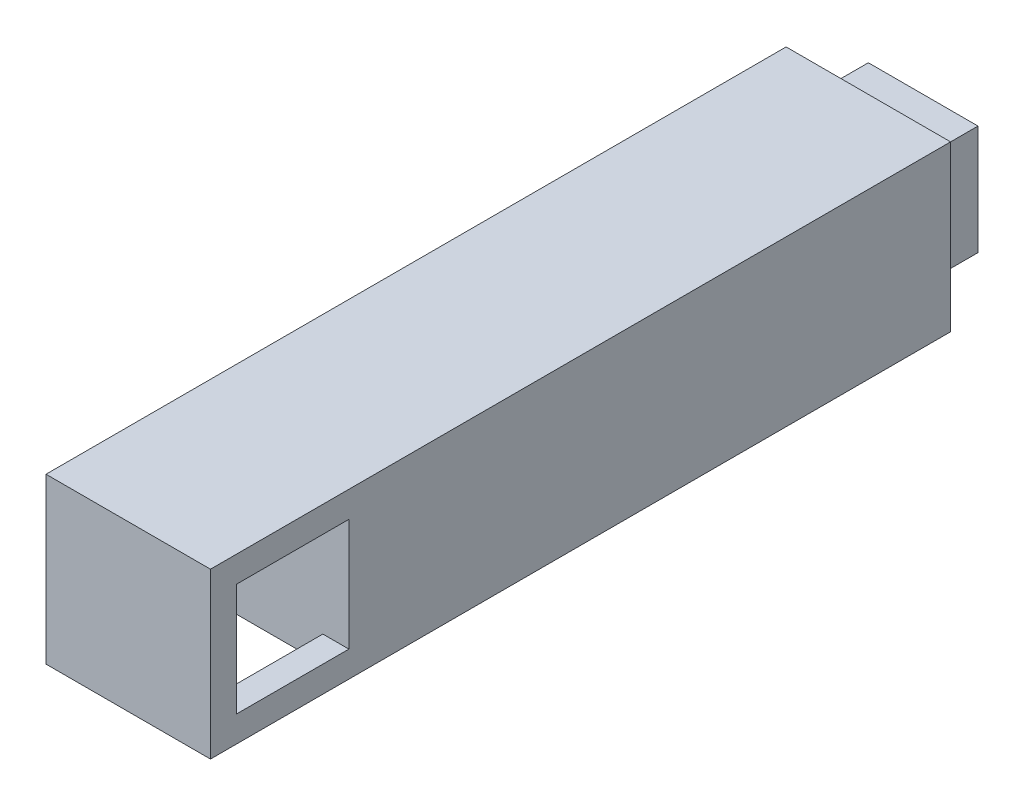
from build123d import *

# Parameters (mm, degrees)
SKETCH1_W           = 30
SKETCH1_H           = 30
BOSS_EXTRUDE1_DEPTH = 135
SKETCH2_W           = 20
SKETCH2_H           = 20
BOSS_EXTRUDE2_DEPTH = 10
SKETCH3_W           = 20.5
SKETCH3_H           = 20.5
CUT_EXTRUDE1_DEPTH  = 15
SKETCH4_W           = 20.5
SKETCH4_H           = 20.5
CUT_EXTRUDE3_DEPTH  = 15


with BuildPart() as part:
    # Sketch1 → Boss-Extrude1 (new body)
    with BuildSketch(Plane.XY):
        Rectangle(SKETCH1_W, SKETCH1_H)
    extrude(amount=BOSS_EXTRUDE1_DEPTH)

    # Sketch2 → Boss-Extrude2 (add)
    with BuildSketch(Plane.XY):
        Rectangle(SKETCH2_W, SKETCH2_H)
    extrude(amount=-BOSS_EXTRUDE2_DEPTH)

    # Sketch3 → Cut-Extrude1 (cut)
    with BuildSketch(Plane(origin=(15, 0, 0), x_dir=(0, 0, -1), z_dir=(1, 0, 0))):
        with Locations((-120, 0)):
            Rectangle(SKETCH3_W, SKETCH3_H)
    extrude(amount=-CUT_EXTRUDE1_DEPTH, mode=Mode.SUBTRACT)

    # Sketch4 → Cut-Extrude3 (cut)
    with BuildSketch(Plane.XZ.offset(15)):
        with Locations((0, 120)):
            Rectangle(SKETCH4_W, SKETCH4_H)
    extrude(amount=-CUT_EXTRUDE3_DEPTH, mode=Mode.SUBTRACT)


solid = part.part
